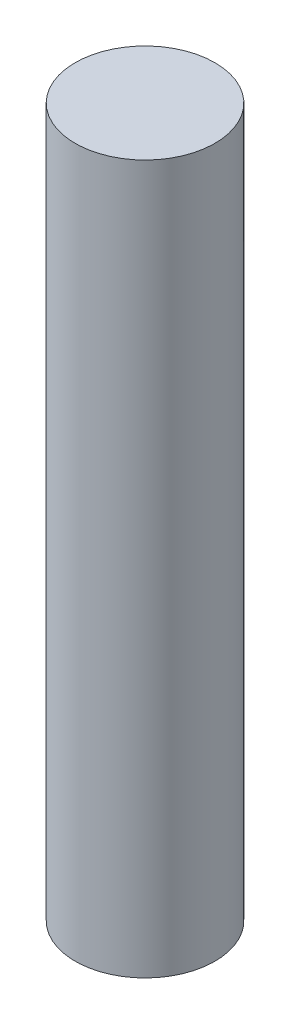
from build123d import *

# Parameters (mm, degrees)
SKETCH1_R           = 1.8796
BOSS_EXTRUDE1_DEPTH = 19.05


with BuildPart() as part:
    # Sketch1 → Boss-Extrude1 (new body)
    with BuildSketch(Plane(origin=(0, 0, 0), x_dir=(1, 0, 0), z_dir=(0, 1, 0))):
        with Locations(Location((0, 0, 0), (0, 0, 90))):
            Circle(SKETCH1_R)
    extrude(amount=BOSS_EXTRUDE1_DEPTH)


solid = part.part
